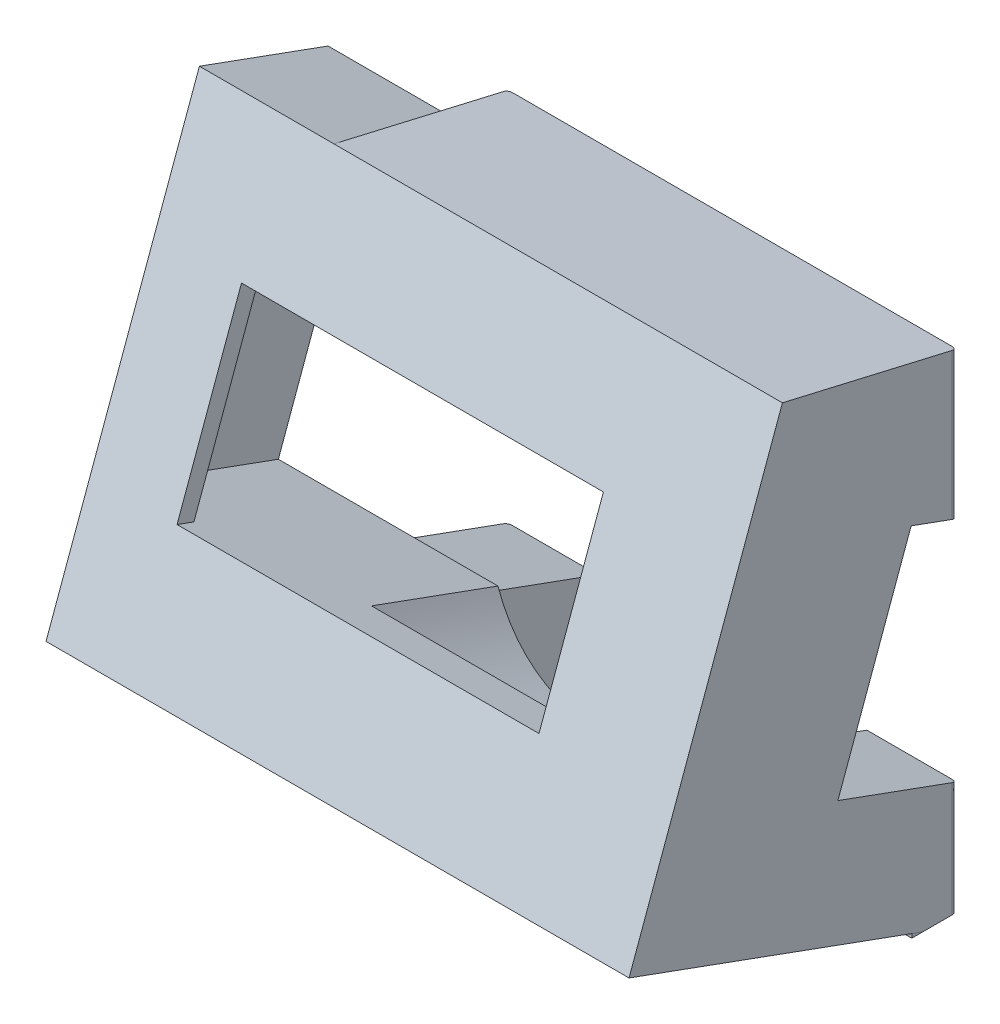
from build123d import *

# Parameters (mm, degrees)
SKETCH2_W            = 6
SKETCH2_H            = 6
BOSS_EXTRUDE1_DEPTH  = 5
SKETCH3_W            = 200
SKETCH3_H            = 20
CUT_EXTRUDE1_DEPTH   = 5
SKETCH4_W            = 5
SKETCH4_H            = 5
CUT_EXTRUDE2_DEPTH   = 5
SKETCH6_W            = 100
SKETCH6_H            = 20
BOSS_EXTRUDE2_DEPTH  = 100
BOSS_EXTRUDE3_DEPTH  = 100
CUT_EXTRUDE4_DEPTH   = 100
BOSS_EXTRUDE5_DEPTH  = 100
SKETCH14_R           = 12.5
CUT_EXTRUDE5_DEPTH   = 100
SKETCH15_R           = 15
SKETCH15_R_2         = 12.5
BOSS_EXTRUDE6_DEPTH  = 40
SKETCH16_W           = 50
SKETCH16_H           = 61.072294376
CUT_EXTRUDE10_DEPTH  = 35
SKETCH15_4_R         = 15
SKETCH15_4_R_2       = 12.5
CUT_EXTRUDE11_DEPTH  = 15
BOSS_EXTRUDE7_DEPTH  = 5
SKETCH23_R           = 15
SKETCH23_R_2         = 12.5
BOSS_EXTRUDE8_DEPTH  = 25
SKETCH21_W           = 50
SKETCH21_H           = 55
CUT_EXTRUDE12_DEPTH  = 35
SKETCH22_W           = 50
SKETCH22_H           = 55
BOSS_EXTRUDE9_DEPTH  = 5
SKETCH23_3_R         = 12.5
CUT_EXTRUDE13_DEPTH  = 20
CUT_EXTRUDE15_DEPTH  = 3
CUT_EXTRUDE16_DEPTH  = 5
SKETCH28_3_W         = 50
SKETCH28_3_H         = 5
BOSS_EXTRUDE12_DEPTH = 5
SKETCH31_W           = 50
SKETCH31_H           = 50
SKETCH31_W_2         = 24
SKETCH31_H_2         = 12.7
BOSS_EXTRUDE13_DEPTH = 20
SKETCH34_W           = 50
SKETCH34_H           = 50
CUT_EXTRUDE19_DEPTH  = 105
CUT_EXTRUDE20_DEPTH  = 110
SKETCH38_R           = 15
SKETCH38_R_2         = 12.5
CUT_EXTRUDE21_DEPTH  = 20
BOSS_EXTRUDE15_DEPTH = 50
SKETCH42_W           = 30
SKETCH42_H           = 18.394120173
CUT_EXTRUDE24_DEPTH  = 55
CUT_EXTRUDE25_DEPTH  = 55
FILLET1_R            = 0.5
BOSS_EXTRUDE16_DEPTH = 10
BOSS_EXTRUDE17_DEPTH = 10
CUT_EXTRUDE26_DEPTH  = 50
SKETCH49_W           = 15
SKETCH49_H           = 50
BOSS_EXTRUDE18_DEPTH = 20
CUT_EXTRUDE27_DEPTH  = 15
SKETCH47_W           = 7.5
SKETCH47_H           = 21
CUT_EXTRUDE28_DEPTH  = 18
SKETCH47_4_W         = 40.35
SKETCH47_4_H         = 21
SKETCH47_4_W_2       = 24
SKETCH47_4_H_2       = 12.7
CUT_EXTRUDE29_DEPTH  = 20
CUT_EXTRUDE30_DEPTH  = 15


with BuildPart() as part:
    # Sketch2 → Boss-Extrude1 (new body)
    with BuildSketch(Plane.XY):
        Polygon((-100, 75), (-100, -45), (-60, -45), (-60, -65), (0, -65), (60, -65), (60, -45), (100, -45), (100, 75), align=None)
        with Locations((55, -50)):
            Rectangle(SKETCH2_W, SKETCH2_H, mode=Mode.SUBTRACT)
        with Locations((-55, -50)):
            Rectangle(SKETCH2_W, SKETCH2_H, mode=Mode.SUBTRACT)
    extrude(amount=BOSS_EXTRUDE1_DEPTH)

    # Sketch3 → Cut-Extrude1 (cut)
    with BuildSketch(Plane.XY.offset(5)):
        with Locations((0, 65)):
            Rectangle(SKETCH3_W, SKETCH3_H)
    extrude(amount=-CUT_EXTRUDE1_DEPTH, mode=Mode.SUBTRACT)

    # Sketch4 → Cut-Extrude2 (cut)
    with BuildSketch(Plane(origin=(0, 0, 0), x_dir=(-1, 0, 0), z_dir=(0, 0, -1))):
        with Locations((-97.5, 47.5)):
            Rectangle(SKETCH4_W, SKETCH4_H)
        Polygon((95, 50), (95, 45), (97.5, 45), (100, 45), (100, 50), align=None)
        with Locations((-97.5, 5)):
            Rectangle(SKETCH4_W, SKETCH4_H)
        with Locations((97.5, 5)):
            Rectangle(SKETCH4_W, SKETCH4_H)
        with Locations((-97.5, -37.5)):
            Rectangle(SKETCH4_W, SKETCH4_H)
        Polygon((100, -35), (95, -35), (95, -40), (97.5, -40), (100, -40), align=None)
    extrude(amount=-CUT_EXTRUDE2_DEPTH, mode=Mode.SUBTRACT)

    # Sketch6 → Boss-Extrude2 (add)
    with BuildSketch(Plane(origin=(0, 0, 0), x_dir=(-1, 0, 0), z_dir=(0, 0, -1))):
        with Locations((0, -55)):
            Rectangle(SKETCH6_W, SKETCH6_H)
    extrude(amount=BOSS_EXTRUDE2_DEPTH)

    # Sketch8 → Boss-Extrude3 (add)
    with BuildSketch(Plane(origin=(50, 0, 0), x_dir=(0, 0, -1), z_dir=(1, 0, 0))):
        Polygon((42.17911114, -45), (100, -45), (100, 55), (78.57613456, 55), (63.797824283, 14.396926208), (60.37762285, 5), (56.957421417, -4.396926208), align=None)
    extrude(amount=-BOSS_EXTRUDE3_DEPTH)

    # Sketch12 → Cut-Extrude4 (cut)
    with BuildSketch(Plane(origin=(50, 0, 0), x_dir=(0, 0, -1), z_dir=(1, 0, 0))):
        Polygon((78.57613456, 55), (42.17911114, -45), (47.5, -45), (83.89702342, 55), align=None)
    extrude(amount=-CUT_EXTRUDE4_DEPTH, mode=Mode.SUBTRACT)

    # Sketch13 → Boss-Extrude5 (add)
    with BuildSketch(Plane(origin=(0, -20.530205756, -56.406276742), x_dir=(1, 0, 0), z_dir=(0, 0.3420201432707361, 0.9396926208059023))):
        with BuildLine():
            ThreePointArc((10, 27.168677492), (7.071067812, 34.239745304), (0, 37.168677492))
            ThreePointArc((0, 37.168677492), (-7.071067812, 20.09760968), (10, 27.168677492))
        make_face()
    extrude(amount=BOSS_EXTRUDE5_DEPTH)

    # Sketch14 → Cut-Extrude5 (cut)
    with BuildSketch(Plane(origin=(0, 13.671808571, 37.562985339), x_dir=(1, 0, 0), z_dir=(0, 0.34202014327073604, 0.9396926208059022))):
        with Locations((0, 27.168677492)):
            Circle(SKETCH14_R)
    extrude(amount=-CUT_EXTRUDE5_DEPTH, mode=Mode.SUBTRACT)

    # Sketch15 → Boss-Extrude6 (add)
    with BuildSketch(Plane(origin=(0, 13.671808571, 37.562985339), x_dir=(1, 0, 0), z_dir=(0, 0.3420201432707362, 0.9396926208059023))):
        with Locations((0, 27.168677492)):
            Circle(SKETCH15_R)
        with Locations((0, 27.168677492)):
            Circle(SKETCH15_R_2, mode=Mode.SUBTRACT)
    extrude(amount=-BOSS_EXTRUDE6_DEPTH)

    # Sketch16 → Cut-Extrude10 (cut)
    with BuildSketch(Plane(origin=(0, 0, -30), x_dir=(-1, 0, 0), z_dir=(0, 0, -1))):
        with Locations((0, 30.536147188)):
            Rectangle(SKETCH16_W, SKETCH16_H)
    extrude(amount=-CUT_EXTRUDE10_DEPTH, mode=Mode.SUBTRACT)


with BuildPart() as cut_extrude10_piece_1:
    # of the separate pieces the step leaves, piece 1, a body of its own (cut_extrude10_pieces)
    add(part.part.solids().sort_by_distance((-100, 55, 0))[0])

    # Sketch18 → Boss-Extrude7 (add)
    with BuildSketch(Plane.XY.offset(5)):
        Polygon((30, 55), (25, 55), (25, 0), (-25, 0), (-25, 55), (-30, 55), (-30, -5), (30, -5), (30, 0), align=None)
    extrude(amount=BOSS_EXTRUDE7_DEPTH)



with BuildPart() as cut_extrude10_piece_2:
    # of the separate pieces the step leaves, piece 2, a body of its own (cut_extrude10_pieces)
    add(part.part.solids().sort_by_distance((15, 39.202014327, 28.270750371))[0])

    # Sketch15<4> → Cut-Extrude11 (cut)
    with BuildSketch(Plane(origin=(0, 13.671808571, 37.562985339), x_dir=(1, 0, 0), z_dir=(0, 0.3420201432707362, 0.9396926208059023))):
        with Locations((0, 27.168677492)):
            Circle(SKETCH15_4_R)
        with Locations((0, 27.168677492)):
            Circle(SKETCH15_4_R_2, mode=Mode.SUBTRACT)
    extrude(amount=-CUT_EXTRUDE11_DEPTH, mode=Mode.SUBTRACT)

    # Sketch23 → Boss-Extrude8 (add)
    with BuildSketch(Plane(origin=(0, 8.541506422, 23.467596027), x_dir=(1, 0, 0), z_dir=(0, 0.34202014327073627, 0.9396926208059023))):
        with Locations((0, 27.168677492)):
            Circle(SKETCH23_R)
        with Locations((0, 27.168677492)):
            Circle(SKETCH23_R_2, mode=Mode.SUBTRACT)
    extrude(amount=-BOSS_EXTRUDE8_DEPTH)

    # Sketch21 → Cut-Extrude12 (cut)
    with BuildSketch(Plane(origin=(0, 0, -30), x_dir=(-1, 0, 0), z_dir=(0, 0, -1))):
        with Locations((0, 27.5)):
            Rectangle(SKETCH21_W, SKETCH21_H)
    extrude(amount=-CUT_EXTRUDE12_DEPTH, mode=Mode.SUBTRACT)


with BuildPart() as cut_extrude10_piece_1_1:
    add(cut_extrude10_piece_1.part)

    add(cut_extrude10_piece_2.part)  # Boss-Extrude9 merges Cut-Extrude10 piece 2
    # Sketch22 → Boss-Extrude9 (add)
    with BuildSketch(Plane(origin=(0, 0, 0), x_dir=(-1, 0, 0), z_dir=(0, 0, -1))):
        with Locations((0, 27.5)):
            Rectangle(SKETCH22_W, SKETCH22_H)
    extrude(amount=-BOSS_EXTRUDE9_DEPTH)

    # Sketch23<3> → Cut-Extrude13 (cut)
    with BuildSketch(Plane(origin=(0, 8.541506422, 23.467596027), x_dir=(1, 0, 0), z_dir=(0, 0.34202014327073627, 0.9396926208059023))):
        with Locations((0, 27.168677492)):
            Circle(SKETCH23_3_R)
    extrude(amount=-CUT_EXTRUDE13_DEPTH, mode=Mode.SUBTRACT)

    # Sketch27 → Cut-Extrude15 (cut)
    with BuildSketch(Plane(origin=(0, 8.541506422, 23.467596027), x_dir=(1, 0, 0), z_dir=(0, 0.34202014327073627, 0.9396926208059023))):
        with BuildLine():
            ThreePointArc((2, 42.034746239), (0, 42.168677492), (-2, 42.034746239))
            Line((-2, 42.034746239), (-2, 39.507640171))
            ThreePointArc((-2, 39.507640171), (0, 39.668677492), (2, 39.507640171))
            Line((2, 39.507640171), (2, 42.034746239))
        make_face()
        with BuildLine():
            Line((-12.338962679, 29.168677492), (-14.866068747, 29.168677492))
            ThreePointArc((-14.866068747, 29.168677492), (-15, 27.168677492), (-14.866068747, 25.168677492))
            Line((-14.866068747, 25.168677492), (-12.338962679, 25.168677492))
            ThreePointArc((-12.338962679, 25.168677492), (-12.5, 27.168677492), (-12.338962679, 29.168677492))
        make_face()
        with BuildLine():
            ThreePointArc((14.866068747, 25.168677492), (15, 27.168677492), (14.866068747, 29.168677492))
            Line((14.866068747, 29.168677492), (12.338962679, 29.168677492))
            ThreePointArc((12.338962679, 29.168677492), (12.5, 27.168677492), (12.338962679, 25.168677492))
            Line((12.338962679, 25.168677492), (14.866068747, 25.168677492))
        make_face()
        with BuildLine():
            ThreePointArc((2, 14.829714813), (0, 14.668677492), (-2, 14.829714813))
            Line((-2, 14.829714813), (-2, 12.302608744))
            ThreePointArc((-2, 12.302608744), (0, 12.168677492), (2, 12.302608744))
            Line((2, 12.302608744), (2, 14.829714813))
        make_face()
    extrude(amount=-CUT_EXTRUDE15_DEPTH, mode=Mode.SUBTRACT)

    # Sketch28 → Cut-Extrude16 (cut)
    with BuildSketch(Plane.XY.offset(10)):
        Polygon((25, 0), (-25, 0), (-30, 0), (-30, -5), (30, -5), (30, 0), align=None)
    extrude(amount=-CUT_EXTRUDE16_DEPTH, mode=Mode.SUBTRACT)

    # Sketch28<3> → Boss-Extrude12 (add)
    with BuildSketch(Plane.XY.offset(10)):
        with Locations((0, 2.5)):
            Rectangle(SKETCH28_3_W, SKETCH28_3_H)
    extrude(amount=-BOSS_EXTRUDE12_DEPTH)

    # Sketch31 → Boss-Extrude13 (add)
    with BuildSketch(Plane(origin=(0, 8.541506422, 23.467596027), x_dir=(1, 0, 0), z_dir=(0, 0.34202014327073627, 0.9396926208059023))):
        with Locations((0, 27.168677492)):
            Rectangle(SKETCH31_W, SKETCH31_H)
        with Locations((-5.65, 27.168677492)):
            Rectangle(SKETCH31_W_2, SKETCH31_H_2, mode=Mode.SUBTRACT)
    extrude(amount=BOSS_EXTRUDE13_DEPTH)

    # Sketch34 → Cut-Extrude19 (cut)
    with BuildSketch(Plane(origin=(0, 0, -100), x_dir=(-1, 0, 0), z_dir=(0, 0, -1))):
        Polygon((-100, 55), (-100, -65), (100, -65), (100, 55), (30, 55), (30, 0), (-30, 0), (-30, 55), align=None)
        with Locations((0, 30)):
            Rectangle(SKETCH34_W, SKETCH34_H)
    extrude(amount=-CUT_EXTRUDE19_DEPTH, mode=Mode.SUBTRACT)


with BuildPart() as cut_extrude19_piece_1:
    # of the separate pieces the step leaves, piece 1, a body of its own (cut_extrude19_pieces)
    add(cut_extrude10_piece_1_1.part.solids().sort_by_distance((-30, 55, 0))[0])


with BuildPart() as cut_extrude19_piece_2:
    # of the separate pieces the step leaves, piece 2, a body of its own (cut_extrude19_pieces)
    add(cut_extrude10_piece_1_1.part.solids().sort_by_distance((30, 55, -100))[0])


with BuildPart() as cut_extrude20_tool:
    # Sketch34<3> → Cut-Extrude20 (new body)
    with BuildSketch(Plane(origin=(0, 0, -100), x_dir=(-1, 0, 0), z_dir=(0, 0, -1))):
        Polygon((-25, 55), (-30, 55), (-30, 0), (30, 0), (30, 55), (25, 55), (25, 5), (-25, 5), align=None)
    extrude(amount=-CUT_EXTRUDE20_DEPTH)


with BuildPart() as cut_extrude19_piece_1_1:
    add(cut_extrude19_piece_1.part)

    # Cut-Extrude20: cut by cut_extrude20_tool
    add(cut_extrude20_tool.part, mode=Mode.SUBTRACT)

    # Sketch38 → Cut-Extrude21 (cut)
    with BuildSketch(Plane(origin=(0, 1.701103557, 4.673743611), x_dir=(-1, 0, 0), z_dir=(0, -0.3420201432707364, -0.9396926208059022))):
        with Locations((0, 27.168677492)):
            Circle(SKETCH38_R)
        with Locations((0, 27.168677492)):
            Circle(SKETCH38_R_2, mode=Mode.SUBTRACT)
    extrude(amount=-CUT_EXTRUDE21_DEPTH, mode=Mode.SUBTRACT)

    # Sketch36 → Boss-Extrude15 (add)
    with BuildSketch(Plane(origin=(25, 0, 0), x_dir=(0, 0, -1), z_dir=(1, 0, 0))):
        Polygon((5, 57.564027698), (-24.418709893, 64.404430564), (-5.624857477, 57.564027698), (-10.755159626, 43.468638386), (-5, 41.373931589), (-5, 55), (0, 55), (0, 45), (5, 45), align=None)
        Polygon((-17.595562491, 24.67478597), (-22.72586464, 10.579396658), (-8.770337016, 5.5), (-5, 5.5), (-5, 20.09037614), align=None)
    extrude(amount=-BOSS_EXTRUDE15_DEPTH)

    # Sketch42 → Cut-Extrude24 (cut)
    with BuildSketch(Plane(origin=(0, 2.037890236, -0.741731386), x_dir=(1, 0, 0), z_dir=(0, -0.9396926208059021, 0.3420201432707363))):
        with Locations((0, 15.776633978)):
            Rectangle(SKETCH42_W, SKETCH42_H)
    extrude(amount=-CUT_EXTRUDE24_DEPTH, mode=Mode.SUBTRACT)

    # Sketch43 → Cut-Extrude25 (cut)
    with BuildSketch(Plane.ZY.offset(25)):
        Polygon((5, 55), (5, 64.404430564), (-5, 64.404430564), (-5, 45), (5, 45), align=None)
    extrude(amount=-CUT_EXTRUDE25_DEPTH, mode=Mode.SUBTRACT)

    # Fillet1
    fillet1_edges = [cut_extrude19_piece_1_1.edges().sort_by_distance(p)[0] for p in [
        (-25, 50.6315736, 5),
        (-25, 12.79518807, 5),
        (25, 12.79518807, 5),
        (25, 50.6315736, 5),
    ]]
    fillet(fillet1_edges, radius=FILLET1_R)

    # Sketch45 → Boss-Extrude16 (add)
    with BuildSketch(Plane.ZY.offset(25)):
        Polygon((10, 5.947560724), (8.770337016, 5.5), (10, 5.5), align=None)
    extrude(amount=-BOSS_EXTRUDE16_DEPTH)

    # Sketch48 → Cut-Extrude26 (cut)
    with BuildSketch(Plane.ZY.offset(25)):
        Polygon((5, 41.373931589), (10.755159626, 43.468638386), (10.071119339, 45.348023628), (5, 43.502287134), align=None)
        Polygon((5, 20.09037614), (5, 18.09037614), (18.238350101, 22.908741527), (17.595562491, 24.67478597), align=None)
    extrude(amount=-CUT_EXTRUDE26_DEPTH, mode=Mode.SUBTRACT)

    # Sketch49 → Boss-Extrude18 (add)
    with BuildSketch(Plane(origin=(0, 15.381909287, 42.261448443), x_dir=(1, 0, 0), z_dir=(0, 0.3420201432707363, 0.9396926208059021))):
        with Locations((-32.5, 27.168677492)):
            Rectangle(SKETCH49_W, SKETCH49_H)
    extrude(amount=-BOSS_EXTRUDE18_DEPTH)

    # Sketch50 → Cut-Extrude27 (cut)
    with BuildSketch(Plane.ZY.offset(40)):
        Polygon((10.071119339, 45.348023628), (10.071119339, 59.18233467), (5.624857477, 57.564027698), align=None)
    extrude(amount=-CUT_EXTRUDE27_DEPTH, mode=Mode.SUBTRACT)

    # Sketch47 → Cut-Extrude28 (cut)
    with BuildSketch(Plane(origin=(0, 8.541506422, 23.467596027), x_dir=(-1, 0, 0), z_dir=(0, -0.3420201432707363, -0.9396926208059021))):
        with Locations((-13.75, 27.168677492)):
            Rectangle(SKETCH47_W, SKETCH47_H)
        with Locations((34.1, 27.168677492)):
            Rectangle(SKETCH47_W, SKETCH47_H)
    extrude(amount=-CUT_EXTRUDE28_DEPTH, mode=Mode.SUBTRACT)

    # Sketch47<4> → Cut-Extrude29 (cut)
    with BuildSketch(Plane(origin=(0, 8.541506422, 23.467596027), x_dir=(-1, 0, 0), z_dir=(0, -0.3420201432707363, -0.9396926208059021))):
        with Locations((10.175, 27.168677492)):
            Rectangle(SKETCH47_4_W, SKETCH47_4_H)
        with Locations((5.65, 27.168677492)):
            Rectangle(SKETCH47_4_W_2, SKETCH47_4_H_2, mode=Mode.SUBTRACT)
    extrude(amount=-CUT_EXTRUDE29_DEPTH, mode=Mode.SUBTRACT)

    # Sketch47<5> → Cut-Extrude30 (cut)
    with BuildSketch(Plane(origin=(0, 8.541506422, 23.467596027), x_dir=(-1, 0, 0), z_dir=(0, -0.3420201432707363, -0.9396926208059021))):
        with BuildLine():
            Line((-13.369741957, 37.668677492), (13.369741957, 37.668677492))
            ThreePointArc((13.369741957, 37.668677492), (0, 44.168677492), (-13.369741957, 37.668677492))
        make_face()
        with BuildLine():
            Line((13.369741957, 16.668677492), (-13.369741957, 16.668677492))
            ThreePointArc((-13.369741957, 16.668677492), (0, 10.168677492), (13.369741957, 16.668677492))
        make_face()
    extrude(amount=-CUT_EXTRUDE30_DEPTH, mode=Mode.SUBTRACT)


with BuildPart() as cut_extrude19_piece_2_1:
    add(cut_extrude19_piece_2.part)

    # Cut-Extrude20: cut by cut_extrude20_tool
    add(cut_extrude20_tool.part, mode=Mode.SUBTRACT)


with BuildPart() as body_2:
    # Sketch46 → Boss-Extrude17 (new body)
    with BuildSketch(Plane(origin=(25, 0, 0), x_dir=(0, 0, -1), z_dir=(1, 0, 0))):
        Polygon((-10, 5.5), (-8.770337016, 5.5), (-10, 5.947560724), align=None)
    extrude(amount=-BOSS_EXTRUDE17_DEPTH)


solid = Compound([cut_extrude19_piece_1_1.part, body_2.part])
